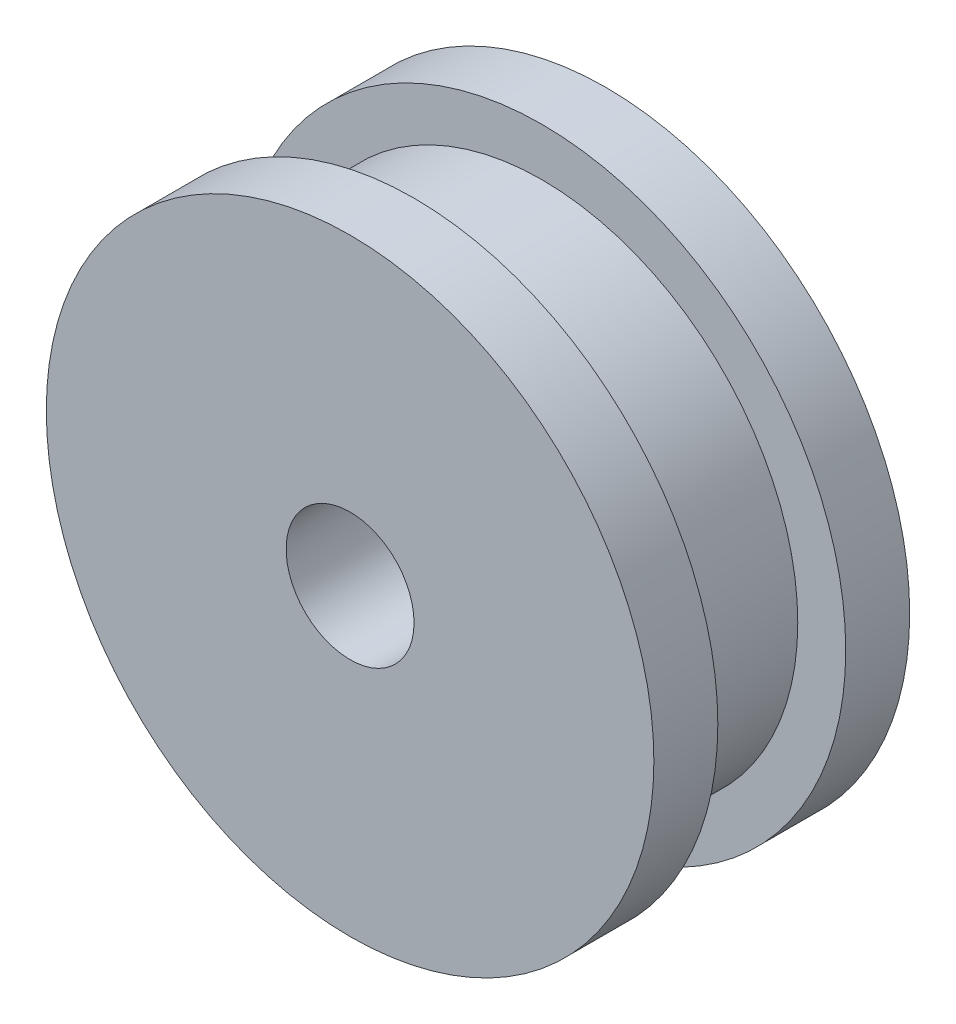
from build123d import *

# Parameters (mm, degrees)
SKETCH1_R           = 4
BOSS_EXTRUDE1_DEPTH = 1
SKETCH3_R           = 4.75
BOSS_EXTRUDE3_DEPTH = 1
SKETCH4_R           = 1
CUT_EXTRUDE1_DEPTH  = 8.818247886


with BuildPart() as part:
    # Sketch1 → Boss-Extrude1 (new, symmetric)
    with BuildSketch(Plane.XY):
        Circle(SKETCH1_R)
    extrude(amount=BOSS_EXTRUDE1_DEPTH, both=True)

    # Sketch3 → Boss-Extrude3 (add)
    with BuildSketch(Plane.XY.offset(1)):
        Circle(SKETCH3_R)
    boss_extrude3 = extrude(amount=BOSS_EXTRUDE3_DEPTH)

    # Mirror1: Boss-Extrude3 across plane
    add(boss_extrude3.mirror(Plane.XY))

    # Sketch4 → Cut-Extrude1 (cut, through all)
    with BuildSketch(Plane.XY.offset(2)):
        Circle(SKETCH4_R)
    extrude(amount=-CUT_EXTRUDE1_DEPTH, mode=Mode.SUBTRACT)


solid = part.part
